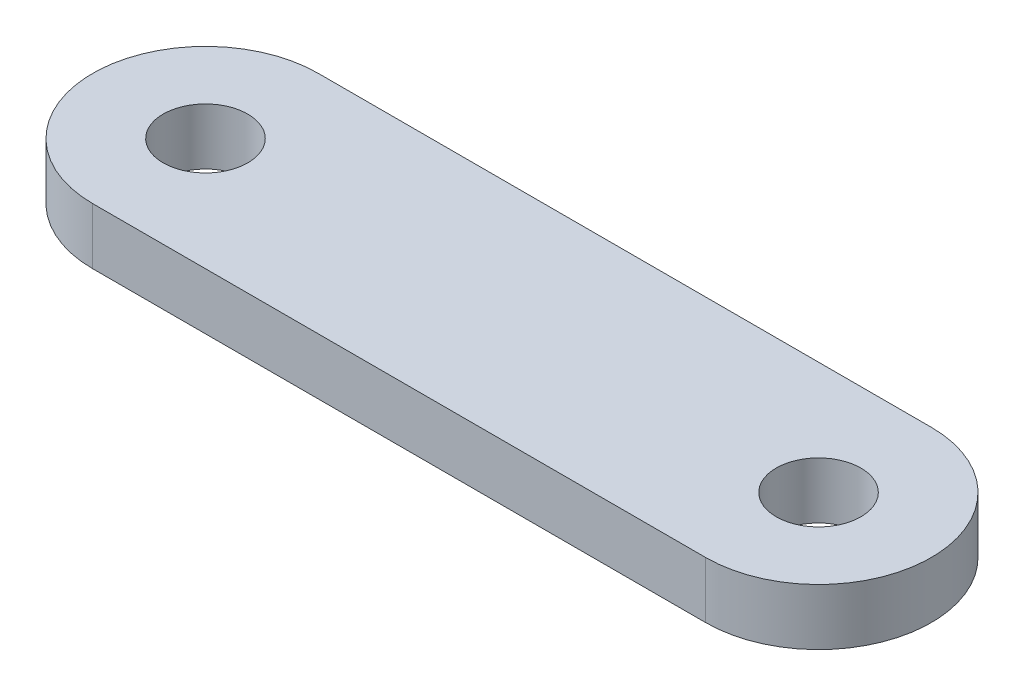
from build123d import *

# Parameters (mm, degrees)
SKETCH1_R           = 1.905
BOSS_EXTRUDE1_DEPTH = 2.54


with BuildPart() as part:
    # Sketch1 → Boss-Extrude1 (new body)
    with BuildSketch(Plane(origin=(0, 0, 0), x_dir=(1, 0, 0), z_dir=(0, 1, 0))):
        with BuildLine():
            Line((-13.8049, 5.08), (13.8049, 5.08))
            ThreePointArc((13.8049, 5.08), (18.8849, 0), (13.8049, -5.08))
            Line((13.8049, -5.08), (-13.8049, -5.08))
            ThreePointArc((-13.8049, -5.08), (-18.8849, 0), (-13.8049, 5.08))
        make_face()
        with Locations(Location((-13.8049, 0, 0), (0, 0, 270))):
            Circle(SKETCH1_R, mode=Mode.SUBTRACT)
        with Locations(Location((13.8049, 0, 0), (0, 0, 270))):
            Circle(SKETCH1_R, mode=Mode.SUBTRACT)
    extrude(amount=BOSS_EXTRUDE1_DEPTH)


solid = part.part
